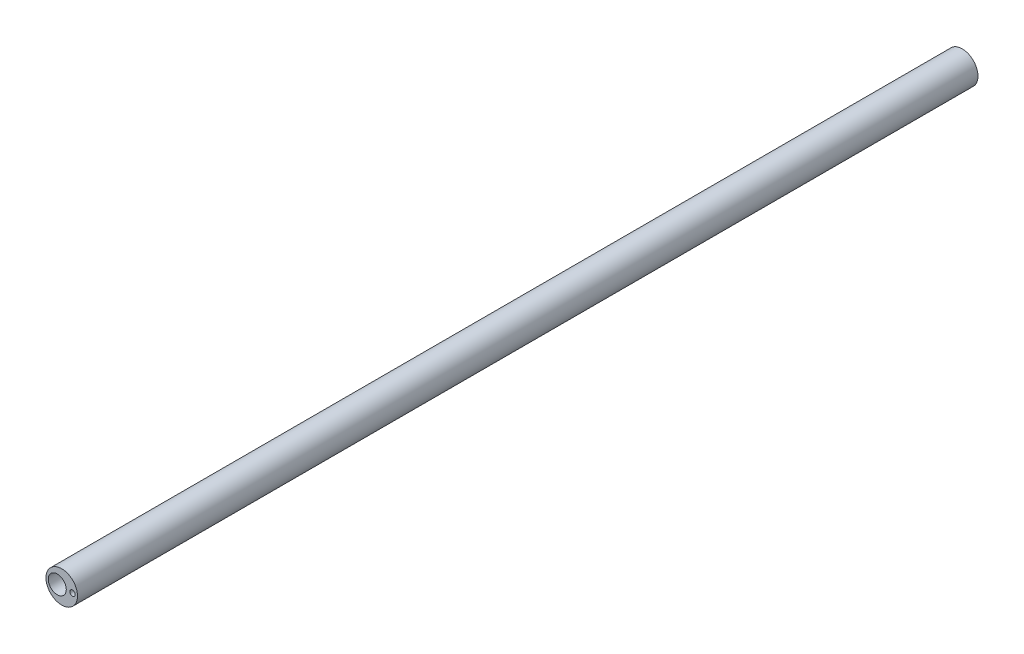
from build123d import *

# Parameters (mm, degrees)
SKETCH1_R           = 1.75
SKETCH1_R_2         = 0.3
SKETCH1_R_3         = 1
BOSS_EXTRUDE1_DEPTH = 100


with BuildPart() as part:
    # Sketch1 → Boss-Extrude1 (new body)
    with BuildSketch(Plane.XY):
        Circle(SKETCH1_R)
        with Locations((1.196, 0)):
            Circle(SKETCH1_R_2, mode=Mode.SUBTRACT)
        with Locations((-0.496, 0)):
            Circle(SKETCH1_R_3, mode=Mode.SUBTRACT)
    extrude(amount=BOSS_EXTRUDE1_DEPTH)


solid = part.part
